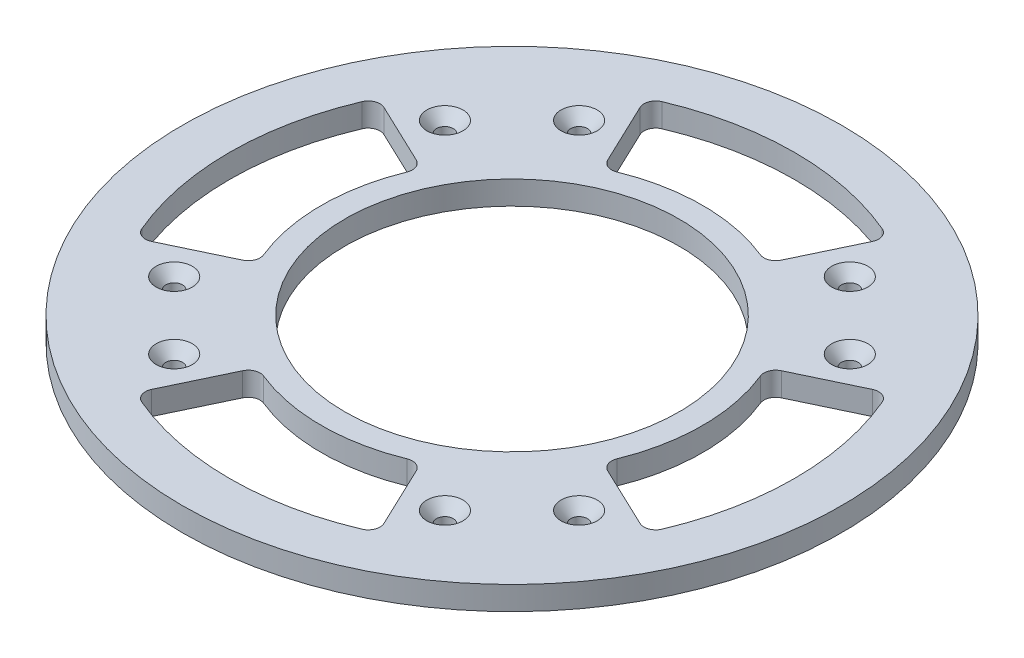
from build123d import *

# Parameters (mm, degrees)
SKETCH1_R                                      = 88.9
BOSS_EXTRUDE1_DEPTH                            = 6.35
CSK_FOR_8_FLAT_HEAD_MACHINE_SCREW1_D           = 4.4958
CSK_FOR_8_FLAT_HEAD_MACHINE_SCREW1_CSINK_D     = 9.7576132
CSK_FOR_8_FLAT_HEAD_MACHINE_SCREW1_CSINK_ANGLE = 82
CIRPATTERN1_COUNT                              = 2
SKETCH4_R                                      = 45.085
CUT_EXTRUDE1_DEPTH                             = 126.88384527
CUT_EXTRUDE2_DEPTH                             = 126.88384527
FILLET1_R                                      = 3.175
CIRPATTERN2_COUNT                              = 4
FILLET1_OF_CIRPATTERN2_R                       = 3.175


with BuildPart() as part:
    # Sketch1 → Boss-Extrude1 (new body)
    with BuildSketch(Plane(origin=(0, 0, 0), x_dir=(1, 0, 0), z_dir=(0, 1, 0))):
        with Locations(Location((0, 0, 0), (0, 0, 270))):
            Circle(SKETCH1_R)
    extrude(amount=BOSS_EXTRUDE1_DEPTH)

    # CSK for #8 Flat Head Machine Screw1 (through all)
    with Locations(Plane(origin=(0, 6.35, 0), x_dir=(-1, 0, 0), z_dir=(0, 1, 0))):
        with Locations((36.5125, -54.61), (-36.5125, -54.61), (36.5125, 54.61), (-36.5125, 54.61), (-54.61, -36.5125), (-54.61, 36.5125), (54.61, 36.5125), (54.61, -36.5125)):
            csk_for_8_flat_head_machine_screw1 = CounterSinkHole(CSK_FOR_8_FLAT_HEAD_MACHINE_SCREW1_D / 2, CSK_FOR_8_FLAT_HEAD_MACHINE_SCREW1_CSINK_D / 2, counter_sink_angle=CSK_FOR_8_FLAT_HEAD_MACHINE_SCREW1_CSINK_ANGLE)

    # CirPattern1: CSK for #8 Flat Head Machine Screw1 ×2 about axis
    cirpattern1_axis = Axis((0, 0, 0), (0, 1, 0))
    for i in range(1, CIRPATTERN1_COUNT):
        add(csk_for_8_flat_head_machine_screw1.rotate(cirpattern1_axis, i * 360 / CIRPATTERN1_COUNT), mode=Mode.SUBTRACT)

    # Sketch4 → Cut-Extrude1 (cut, through all)
    with BuildSketch(Plane(origin=(0, 6.35, 0), x_dir=(1, 0, 0), z_dir=(0, 1, 0))):
        with Locations(Location((0, 0, 0), (0, 0, 270))):
            Circle(SKETCH4_R)
    extrude(amount=-CUT_EXTRUDE1_DEPTH, mode=Mode.SUBTRACT)

    # Sketch5 → Cut-Extrude2 (cut, through all)
    with BuildSketch(Plane(origin=(0, 6.35, 0), x_dir=(1, 0, 0), z_dir=(0, 1, 0))):
        with BuildLine():
            Line((-68.817101203, -32.720736269), (-46.451543312, -22.086496982))
            ThreePointArc((-46.451543312, -22.086496982), (-51.435, 0), (-46.451543312, 22.086496982))
            Line((-46.451543312, 22.086496982), (-68.817101203, 32.720736269))
            ThreePointArc((-68.817101203, 32.720736269), (-76.2, 0), (-68.817101203, -32.720736269))
        make_face()
    cut_extrude2 = extrude(amount=-CUT_EXTRUDE2_DEPTH, mode=Mode.SUBTRACT)

    # Fillet1
    fillet1_edges = [part.edges().sort_by_distance(p)[0] for p in [
        (-68.817101203, 3.175, 32.720736269),
        (-68.817101203, 3.175, -32.720736269),
        (-46.451543312, 3.175, -22.086496982),
        (-46.451543312, 3.175, 22.086496982),
    ]]
    fillet(fillet1_edges, radius=FILLET1_R)

    # CirPattern2: Cut-Extrude2 ×4 about axis
    cirpattern2_axis = Axis((0, 0, 0), (0, 1, 0))
    for i in range(1, CIRPATTERN2_COUNT):
        add(cut_extrude2.rotate(cirpattern2_axis, i * 360 / CIRPATTERN2_COUNT), mode=Mode.SUBTRACT)

    # Fillet1 of CirPattern2
    fillet1_of_cirpattern2_edges = [part.edges().sort_by_distance(p)[0] for p in [
        (32.720736269, 3.175, 68.817101203),
        (-32.720736269, 3.175, 68.817101203),
        (-22.086496982, 3.175, 46.451543312),
        (22.086496982, 3.175, 46.451543312),
        (68.817101203, 3.175, -32.720736269),
        (68.817101203, 3.175, 32.720736269),
        (46.451543312, 3.175, 22.086496982),
        (46.451543312, 3.175, -22.086496982),
        (-32.720736269, 3.175, -68.817101203),
        (32.720736269, 3.175, -68.817101203),
        (22.086496982, 3.175, -46.451543312),
        (-22.086496982, 3.175, -46.451543312),
    ]]
    fillet(fillet1_of_cirpattern2_edges, radius=FILLET1_OF_CIRPATTERN2_R)


solid = part.part
